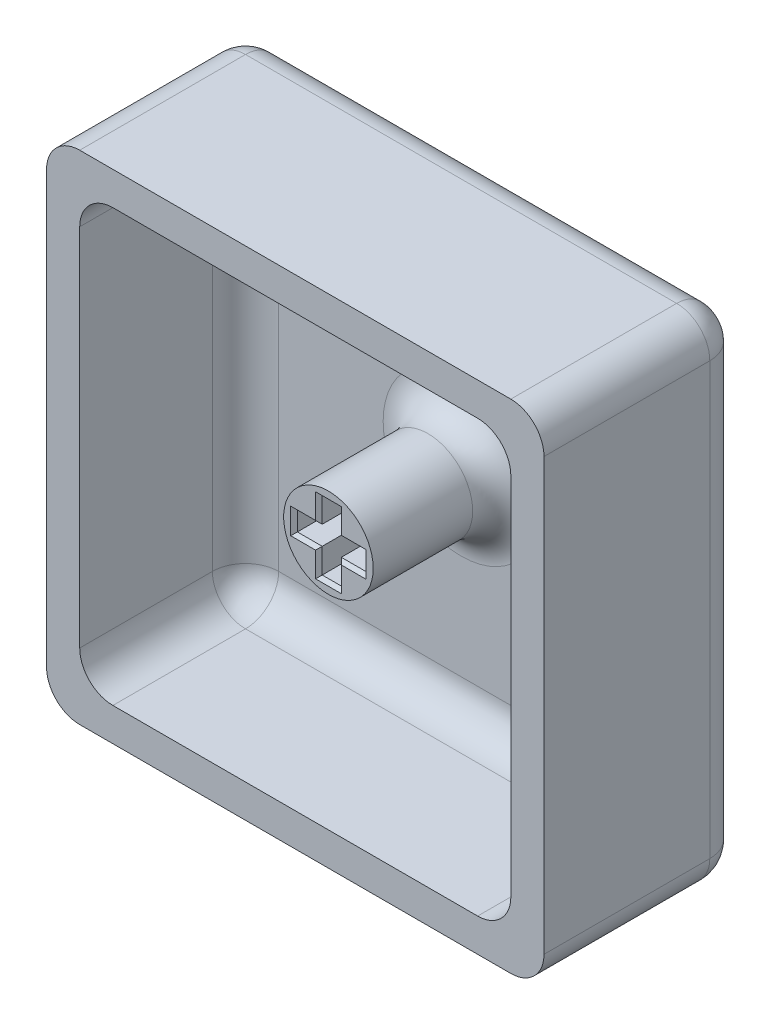
from build123d import *

# Parameters (mm, degrees)
EXTRUDE_1_DEPTH = 10
SKETCH_1_6_R    = 2.7
EXTRUDE_2_DEPTH = 8
EXTRUDE_START   = -2
EXTRUDE_3_DEPTH = 2
FILLET_1_R      = 2
FILLET_5_R      = 2
CHAMFER_1_SIZE  = 0.2


with BuildPart() as part:
    # 草图1 → 凸台-拉伸1 (new body)
    with BuildSketch(Plane.XY):
        with BuildLine():
            Line((13, 15), (-13, 15))
            ThreePointArc((-13, 15), (-14.414213562, 14.414213562), (-15, 13))
            Line((-15, 13), (-15, -13))
            ThreePointArc((-15, -13), (-14.414213562, -14.414213562), (-13, -15))
            Line((-13, -15), (13, -15))
            ThreePointArc((13, -15), (14.414213562, -14.414213562), (15, -13))
            Line((15, -13), (15, 13))
            ThreePointArc((15, 13), (14.414213562, 14.414213562), (13, 15))
        make_face()
        with BuildLine():
            ThreePointArc((-13, 11), (-12.414213562, 12.414213562), (-11, 13))
            Line((-11, 13), (11, 13))
            ThreePointArc((11, 13), (12.414213562, 12.414213562), (13, 11))
            Line((13, 11), (13, -11))
            ThreePointArc((13, -11), (12.414213562, -12.414213562), (11, -13))
            Line((11, -13), (-11, -13))
            ThreePointArc((-11, -13), (-12.414213562, -12.414213562), (-13, -11))
            Line((-13, -11), (-13, 11))
        make_face(mode=Mode.SUBTRACT)
    extrude(amount=EXTRUDE_1_DEPTH)



with BuildPart() as body_2:
    # 草图1<6> → 凸台-拉伸2 (new body)
    with BuildSketch(Plane.XY):
        Circle(SKETCH_1_6_R)
        Polygon((-2.075, -0.575), (-2.075, 0.575), (-0.575, 0.575), (-0.575, 2.075), (0.575, 2.075), (0.575, 0.575), (2.075, 0.575), (2.075, -0.575), (0.575, -0.575), (0.575, -2.075), (-0.575, -2.075), (-0.575, -0.575), align=None, mode=Mode.SUBTRACT)
    extrude(amount=EXTRUDE_2_DEPTH)


with BuildPart() as part_1:
    add(part.part)

    add(body_2.part)  # 凸台-拉伸3 merges body 2
    # 草图1<7> → 凸台-拉伸3 (add)
    with BuildSketch(Plane.XY.offset(EXTRUDE_START)):
        with BuildLine():
            Line((-13, 15), (13, 15))
            ThreePointArc((13, 15), (14.414213562, 14.414213562), (15, 13))
            Line((15, 13), (15, -13))
            ThreePointArc((15, -13), (14.414213562, -14.414213562), (13, -15))
            Line((13, -15), (-13, -15))
            ThreePointArc((-13, -15), (-14.414213562, -14.414213562), (-15, -13))
            Line((-15, -13), (-15, 13))
            ThreePointArc((-15, 13), (-14.414213562, 14.414213562), (-13, 15))
        make_face()
    extrude(amount=EXTRUDE_3_DEPTH)

    # 圆角1
    fillet_1_edges = [part_1.edges().sort_by_distance(p)[0] for p in [
        (-14.414213562, 14.414213562, -2),
        (-15, 0, -2),
        (-14.414213562, -14.414213562, -2),
        (0, -15, -2),
        (14.414213562, -14.414213562, -2),
        (15, 0, -2),
        (14.414213562, 14.414213562, -2),
        (0, 15, -2),
    ]]
    fillet(fillet_1_edges, radius=FILLET_1_R)

    # 圆角5
    fillet_5_edges = [part_1.edges().sort_by_distance(p)[0] for p in [
        (-12.414213562, 12.414213562, 0),
        (0, 13, 0),
        (12.414213562, 12.414213562, 0),
        (13, 0, 0),
        (12.414213562, -12.414213562, 0),
        (0, -13, 0),
        (-12.414213562, -12.414213562, 0),
        (-13, 0, 0),
        (-2.7, 0, 0),
    ]]
    fillet(fillet_5_edges, radius=FILLET_5_R)

    # 倒角1
    chamfer_1_edges = [part_1.edges().sort_by_distance(p)[0] for p in [
        (-0.575, 1.325, 8),
        (-1.325, 0.575, 8),
        (-2.075, 0, 8),
        (-1.325, -0.575, 8),
        (-0.575, -1.325, 8),
        (0, -2.075, 8),
        (0.575, -1.325, 8),
        (1.325, -0.575, 8),
        (2.075, 0, 8),
        (1.325, 0.575, 8),
        (0.575, 1.325, 8),
        (0, 2.075, 8),
    ]]
    chamfer(chamfer_1_edges, length=CHAMFER_1_SIZE)


solid = part_1.part
